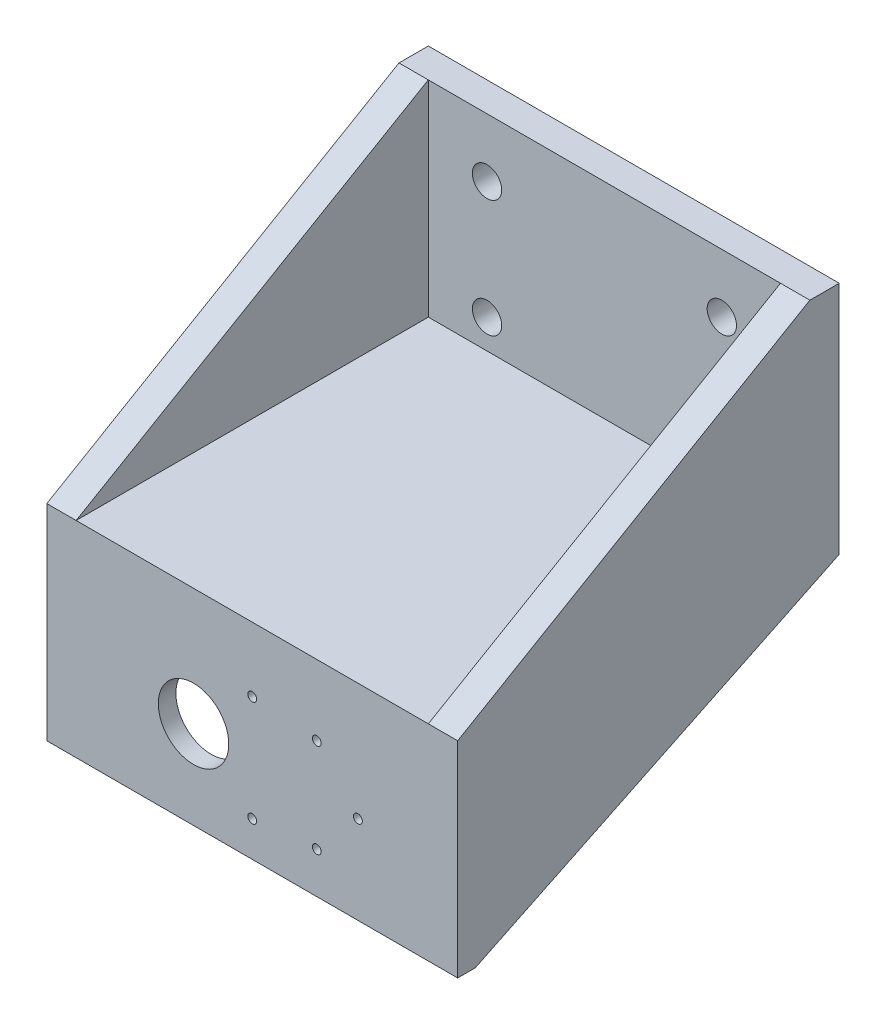
from build123d import *

# Parameters (mm, degrees)
SKETCH_1_W          = 70
SKETCH_1_H          = 40
SKETCH_1_R          = 2.5
EXTRUDE_1_DEPTH     = 5
EXTRUDE_2_DEPTH     = 60
CUT_EXTRUDE_1_DEPTH = 100
EXTRUDE_3_DEPTH     = 30
CUT_EXTRUDE_2_DEPTH = 70
SKETCH_8_R          = 6
SKETCH_8_R_2        = 0.75
CUT_EXTRUDE_3_DEPTH = 5


with BuildPart() as part:
    # 草图1 → 凸台-拉伸1 (new body)
    with BuildSketch(Plane.XY):
        Rectangle(SKETCH_1_W, SKETCH_1_H)
        with Locations((-20, 10)):
            Circle(SKETCH_1_R, mode=Mode.SUBTRACT)
        with Locations((20, 10)):
            Circle(SKETCH_1_R, mode=Mode.SUBTRACT)
        with Locations((-20, -10)):
            Circle(SKETCH_1_R, mode=Mode.SUBTRACT)
        with Locations((20, -10)):
            Circle(SKETCH_1_R, mode=Mode.SUBTRACT)
    extrude(amount=EXTRUDE_1_DEPTH)

    # 草图3 → 凸台-拉伸2 (add)
    with BuildSketch(Plane.XY.offset(5)):
        Polygon((-35, -20), (35, -20), (35, 20), (30, 20), (30, -15), (-30, -15), (-30, 20), (-35, 20), align=None)
    extrude(amount=EXTRUDE_2_DEPTH)

    # 草图4 → 切除-拉伸1 (cut)
    with BuildSketch(Plane.ZY.offset(35)):
        Polygon((5, 20), (65, -15), (65, 20), align=None)
    extrude(amount=-CUT_EXTRUDE_1_DEPTH, mode=Mode.SUBTRACT)

    # 草图5 → 凸台-拉伸3 (add)
    with BuildSketch(Plane.XZ.offset(20)):
        Polygon((30, 0), (35, 0), (35, 65), (-35, 65), (-35, 0), (-30, 0), (-30, 62), (30, 62), align=None)
    extrude(amount=EXTRUDE_3_DEPTH)

    # 草图6 → 切除-拉伸2 (cut)
    with BuildSketch(Plane.ZY.offset(35)):
        Polygon((62, -50), (0, -20), (0, -50), align=None)
    extrude(amount=-CUT_EXTRUDE_2_DEPTH, mode=Mode.SUBTRACT)

    # 草图8 → 切除-拉伸3 (cut)
    with BuildSketch(Plane.XY.offset(65)):
        with Locations((-10, -35)):
            Circle(SKETCH_8_R)
        with Locations((18, -35)):
            Circle(SKETCH_8_R_2)
        with Locations((11, -43)):
            Circle(SKETCH_8_R_2)
        with Locations((0, -44)):
            Circle(SKETCH_8_R_2)
        with Locations((11, -27)):
            Circle(SKETCH_8_R_2)
        with Locations((0, -26)):
            Circle(SKETCH_8_R_2)
    extrude(amount=-CUT_EXTRUDE_3_DEPTH, mode=Mode.SUBTRACT)


solid = part.part
